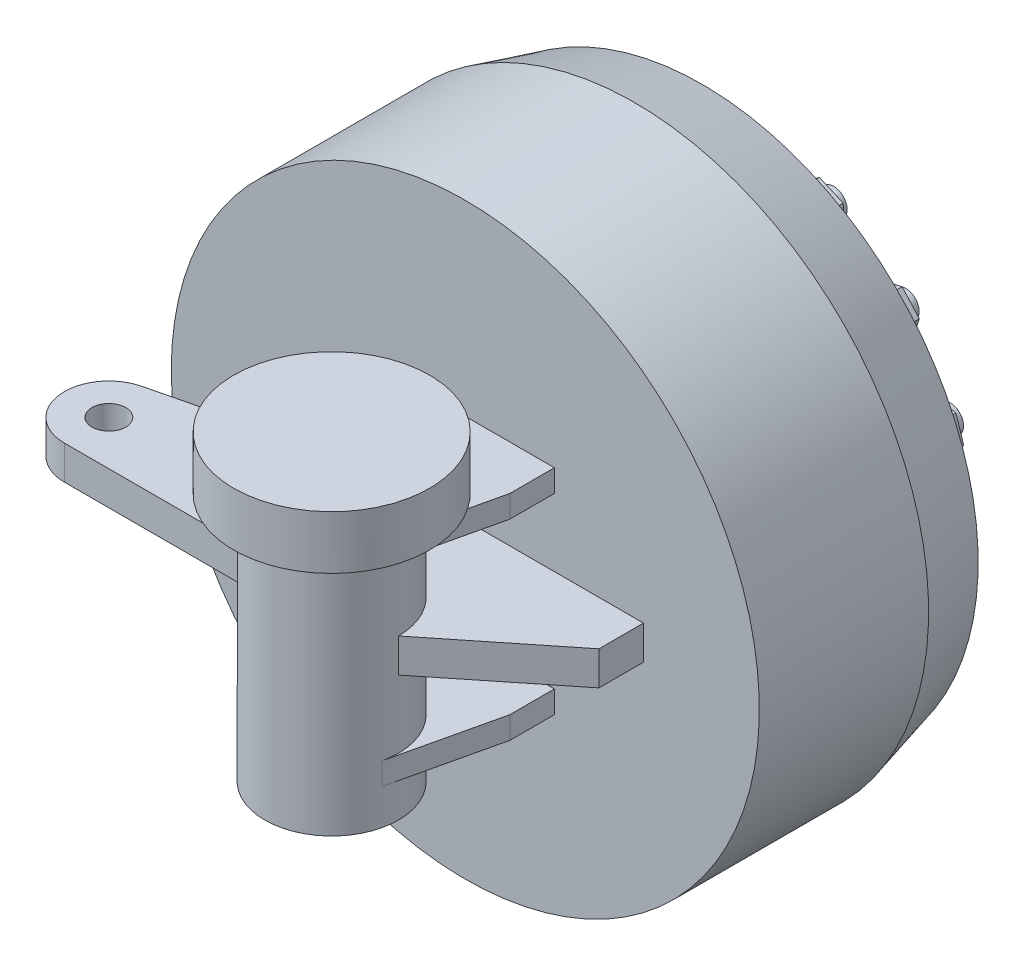
from build123d import *

# Parameters (mm, degrees)
CHAMFER1_SIZE            = 4
FILLET1_R                = 3.5
FILLET2_R                = 3.5
BOSS_EXTRUDE1_DEPTH      = 90
BOSS_EXTRUDE1_DEPTH_BACK = 80
SKETCH2_R                = 37.5
BOSS_EXTRUDE2_START      = 60
BOSS_EXTRUDE2_DEPTH      = 12.5
SKETCH4_R                = 9.5
BOSS_EXTRUDE3_DEPTH      = 9.5
SKETCH6_R                = 55
BOSS_EXTRUDE4_DEPTH      = 30
SKETCH7_R                = 7.5
BOSS_EXTRUDE5_DEPTH      = 25
BOSS_EXTRUDE6_START      = 6
SKETCH7_3_R              = 7.5
BOSS_EXTRUDE6_DEPTH      = 12.5


with BuildPart() as part:
    # Sketch1 → Revolve1 (revolve)
    with BuildSketch(Plane(origin=(0, 0, 0), x_dir=(0, 0, -1), z_dir=(1, 0, 0)), mode=Mode.PRIVATE) as revolve1_sk:
        Polygon((0, 0), (0, 165), (95, 165), (133, 154.817930688), (133, 75), (158, 75), (158, 50), (183, 50), (183, 0), align=None)
    revolve(revolve1_sk.sketch.rotate(Axis((0, 0, -183), (0, 0, 1)), 90), axis=Axis((0, 0, -183), (0, 0, 1)))

    # Chamfer1
    chamfer1_edges = [part.edges().sort_by_distance(p)[0] for p in [
        (50, 0, -183),
    ]]
    chamfer(chamfer1_edges, length=CHAMFER1_SIZE)

    # Fillet1
    fillet1_edges = [part.edges().sort_by_distance(p)[0] for p in [
        (50, 0, -158),
    ]]
    fillet(fillet1_edges, radius=FILLET1_R)

    # Fillet2
    fillet2_edges = [part.edges().sort_by_distance(p)[0] for p in [
        (75, 0, -158),
    ]]
    fillet(fillet2_edges, radius=FILLET2_R)



with BuildPart() as body_2:
    # Sketch2 → Boss-Extrude1 (new, two sides: drawn at the far end of the back side and taken through both)
    with BuildSketch(Plane(origin=(0, 0, 0), x_dir=(1, 0, 0), z_dir=(0, 1, 0)).offset(-BOSS_EXTRUDE1_DEPTH_BACK)):
        with Locations(Location((0, -75, 0), (0, 0, 270))):
            Circle(SKETCH2_R)
    extrude(amount=BOSS_EXTRUDE1_DEPTH + BOSS_EXTRUDE1_DEPTH_BACK)


with BuildPart() as part_1:
    add(part.part)

    add(body_2.part)  # Boss-Extrude2 merges body 2
    # Sketch3 → Boss-Extrude2 (add)
    with BuildSketch(Plane(origin=(0, 0, 0), x_dir=(1, 0, 0), z_dir=(0, 1, 0)).offset(BOSS_EXTRUDE2_START)):
        Polygon((-50, 0), (50, 0), (50, -25), (36.542960266, -83.417960266), (-36.542960266, -83.417960266), (-50, -25), align=None)
    boss_extrude2 = extrude(amount=-BOSS_EXTRUDE2_DEPTH)

    # Mirror1: Boss-Extrude2 across plane
    add(boss_extrude2.mirror(Plane.ZX))

    # Sketch4 → Boss-Extrude3 (add, symmetric)
    with BuildSketch(Plane(origin=(0, 0, 0), x_dir=(1, 0, 0), z_dir=(0, 1, 0))):
        with BuildLine():
            Line((-50, 0), (100, 0))
            Line((100, 0), (100, -25))
            Line((100, -25), (37.5, -75))
            ThreePointArc((37.5, -75), (0, -37.5), (-37.5, -75))
            Line((-37.5, -75), (-150, -75))
            ThreePointArc((-150, -75), (-174.822997079, -52.969649142), (-155.897247359, -25.705505282))
            Line((-155.897247359, -25.705505282), (-50, 0))
        make_face()
        with Locations(Location((-150, -50, 0), (0, 0, 270))):
            Circle(SKETCH4_R, mode=Mode.SUBTRACT)
    extrude(amount=BOSS_EXTRUDE3_DEPTH, both=True)

    # Sketch6 → Boss-Extrude4 (add)
    with BuildSketch(Plane(origin=(0, 60, 0), x_dir=(1, 0, 0), z_dir=(0, 1, 0))):
        with Locations(Location((0, -75, 0), (0, 0, 145.958125966))):
            Circle(SKETCH6_R)
    extrude(amount=BOSS_EXTRUDE4_DEPTH)

    # Sketch7 → Boss-Extrude5 (add)
    with BuildSketch(Plane(origin=(0, 0, -133), x_dir=(-1, 0, 0), z_dir=(0, 0, -1))):
        with Locations((-103.923048454, -60)):
            Circle(SKETCH7_R)
        with Locations((-119.342627444, -12.543415592)):
            Circle(SKETCH7_R)
        with Locations((-70.534230275, -97.082039325)):
            Circle(SKETCH7_R)
        with Locations((-24.949402898, -117.377712088)):
            Circle(SKETCH7_R)
        with Locations((70.534230275, -97.082039325)):
            Circle(SKETCH7_R)
        with Locations((103.923048454, -60)):
            Circle(SKETCH7_R)
        with Locations((119.342627444, -12.543415592)):
            Circle(SKETCH7_R)
        with Locations((114.126781955, 37.082039325)):
            Circle(SKETCH7_R)
        with Locations((89.177379057, 80.295672763)):
            Circle(SKETCH7_R)
        with Locations((48.808397169, 109.625454917)):
            Circle(SKETCH7_R)
        with Locations((-48.808397169, 109.625454917)):
            Circle(SKETCH7_R)
        with Locations((-89.177379057, 80.295672763)):
            Circle(SKETCH7_R)
        with Locations((-114.126781955, 37.082039325)):
            Circle(SKETCH7_R)
        with Locations((0, 120)):
            Circle(SKETCH7_R)
        with Locations((24.949402898, -117.377712088)):
            Circle(SKETCH7_R)
    extrude(amount=BOSS_EXTRUDE5_DEPTH)

    # Sketch7<3> → Boss-Extrude6 (add)
    # profile 1 of 15: a face of its own
    with BuildSketch(Plane(origin=(0, 0, -133), x_dir=(-1, 0, 0), z_dir=(0, 0, -1)).offset(BOSS_EXTRUDE6_START)):
        Polygon((61.994290066, 103.754717158), (60.485551656, 118.109404258), (47.299658759, 123.980142017), (35.622504272, 115.496192676), (37.131242682, 101.141505576), (50.317135579, 95.270767817), align=None)
        with Locations((48.808397169, 109.625454917)):
            Circle(SKETCH7_3_R, mode=Mode.SUBTRACT)
    # profile 2 of 15: a face of its own
    with BuildSketch(Plane(origin=(0, 0, -133), x_dir=(-1, 0, 0), z_dir=(0, 0, -1)).offset(BOSS_EXTRUDE6_START)):
        Polygon((7.216878365, 132.5), (-7.216878365, 132.5), (-14.43375673, 120), (-7.216878365, 107.5), (7.216878365, 107.5), (14.43375673, 120), align=None)
        with Locations((0, 120)):
            Circle(SKETCH7_3_R, mode=Mode.SUBTRACT)
    # profile 3 of 15: a face of its own
    with BuildSketch(Plane(origin=(0, 0, -133), x_dir=(-1, 0, 0), z_dir=(0, 0, -1)).offset(BOSS_EXTRUDE6_START)):
        Polygon((98.83544745, 69.569301137), (103.295723572, 83.29661953), (93.637655179, 94.022991156), (79.519310665, 91.022044389), (75.059034543, 77.294725997), (84.717102935, 66.568354371), align=None)
        with Locations((89.177379057, 80.295672763)):
            Circle(SKETCH7_3_R, mode=Mode.SUBTRACT)
    # profile 4 of 15: a face of its own
    with BuildSketch(Plane(origin=(0, 0, -133), x_dir=(-1, 0, 0), z_dir=(0, 0, -1)).offset(BOSS_EXTRUDE6_START)):
        Polygon((118.587058078, 23.354720933), (128.24512647, 34.081092558), (123.784850348, 47.808410951), (109.666505833, 50.809357717), (100.008437441, 40.082986092), (104.468713563, 26.355667699), align=None)
        with Locations((114.126781955, 37.082039325)):
            Circle(SKETCH7_3_R, mode=Mode.SUBTRACT)
    # profile 5 of 15: a face of its own
    with BuildSketch(Plane(origin=(0, 0, -133), x_dir=(-1, 0, 0), z_dir=(0, 0, -1)).offset(BOSS_EXTRUDE6_START)):
        Polygon((117.833889034, -26.898102692), (131.019781931, -21.027364933), (132.528520341, -6.672677833), (120.851365854, 1.811271508), (107.665472957, -4.059466251), (106.156734547, -18.414153351), align=None)
        with Locations((119.342627444, -12.543415592)):
            Circle(SKETCH7_3_R, mode=Mode.SUBTRACT)
    # profile 6 of 15: a face of its own
    with BuildSketch(Plane(origin=(0, 0, -133), x_dir=(-1, 0, 0), z_dir=(0, 0, -1)).offset(BOSS_EXTRUDE6_START)):
        Polygon((96.706170089, -72.5), (111.139926819, -72.5), (118.356805184, -60), (111.139926819, -47.5), (96.706170089, -47.5), (89.489291724, -60), align=None)
        with Locations((103.923048454, -60)):
            Circle(SKETCH7_3_R, mode=Mode.SUBTRACT)
    # profile 7 of 15: a face of its own
    with BuildSketch(Plane(origin=(0, 0, -133), x_dir=(-1, 0, 0), z_dir=(0, 0, -1)).offset(BOSS_EXTRUDE6_START)):
        Polygon((58.857075788, -105.565988666), (72.042968685, -111.436726425), (83.720123172, -102.952777084), (82.211384762, -88.598089984), (69.025491865, -82.727352225), (57.348337378, -91.211301566), align=None)
        with Locations((70.534230275, -97.082039325)):
            Circle(SKETCH7_3_R, mode=Mode.SUBTRACT)
    # profile 8 of 15: a face of its own
    with BuildSketch(Plane(origin=(0, 0, -133), x_dir=(-1, 0, 0), z_dir=(0, 0, -1)).offset(BOSS_EXTRUDE6_START)):
        Polygon((10.831058383, -120.378658855), (20.489126776, -131.10503048), (34.607471291, -128.104083714), (39.067747413, -114.376765322), (29.40967902, -103.650393696), (15.291334506, -106.651340462), align=None)
        with Locations((24.949402898, -117.377712088)):
            Circle(SKETCH7_3_R, mode=Mode.SUBTRACT)
    # profile 9 of 15: a face of its own
    with BuildSketch(Plane(origin=(0, 0, -133), x_dir=(-1, 0, 0), z_dir=(0, 0, -1)).offset(BOSS_EXTRUDE6_START)):
        Polygon((-39.067747413, -114.376765322), (-34.607471291, -128.104083714), (-20.489126776, -131.10503048), (-10.831058383, -120.378658855), (-15.291334506, -106.651340462), (-29.40967902, -103.650393696), align=None)
        with Locations((-24.949402898, -117.377712088)):
            Circle(SKETCH7_3_R, mode=Mode.SUBTRACT)
    # profile 10 of 15: a face of its own
    with BuildSketch(Plane(origin=(0, 0, -133), x_dir=(-1, 0, 0), z_dir=(0, 0, -1)).offset(BOSS_EXTRUDE6_START)):
        Polygon((-82.211384762, -88.598089984), (-83.720123172, -102.952777084), (-72.042968685, -111.436726425), (-58.857075788, -105.565988666), (-57.348337378, -91.211301566), (-69.025491865, -82.727352225), align=None)
        with Locations((-70.534230275, -97.082039325)):
            Circle(SKETCH7_3_R, mode=Mode.SUBTRACT)
    # profile 11 of 15: a face of its own
    with BuildSketch(Plane(origin=(0, 0, -133), x_dir=(-1, 0, 0), z_dir=(0, 0, -1)).offset(BOSS_EXTRUDE6_START)):
        Polygon((-111.139926819, -47.5), (-118.356805184, -60), (-111.139926819, -72.5), (-96.706170089, -72.5), (-89.489291724, -60), (-96.706170089, -47.5), align=None)
        with Locations((-103.923048454, -60)):
            Circle(SKETCH7_3_R, mode=Mode.SUBTRACT)
    # profile 12 of 15: a face of its own
    with BuildSketch(Plane(origin=(0, 0, -133), x_dir=(-1, 0, 0), z_dir=(0, 0, -1)).offset(BOSS_EXTRUDE6_START)):
        Polygon((-120.851365854, 1.811271508), (-132.528520341, -6.672677833), (-131.019781931, -21.027364933), (-117.833889034, -26.898102692), (-106.156734547, -18.414153351), (-107.665472957, -4.059466251), align=None)
        with Locations((-119.342627444, -12.543415592)):
            Circle(SKETCH7_3_R, mode=Mode.SUBTRACT)
    # profile 13 of 15: a face of its own
    with BuildSketch(Plane(origin=(0, 0, -133), x_dir=(-1, 0, 0), z_dir=(0, 0, -1)).offset(BOSS_EXTRUDE6_START)):
        Polygon((-109.666505833, 50.809357717), (-123.784850348, 47.808410951), (-128.24512647, 34.081092558), (-118.587058078, 23.354720933), (-104.468713563, 26.355667699), (-100.008437441, 40.082986092), align=None)
        with Locations((-114.126781955, 37.082039325)):
            Circle(SKETCH7_3_R, mode=Mode.SUBTRACT)
    # profile 14 of 15: a face of its own
    with BuildSketch(Plane(origin=(0, 0, -133), x_dir=(-1, 0, 0), z_dir=(0, 0, -1)).offset(BOSS_EXTRUDE6_START)):
        Polygon((-79.519310665, 91.022044389), (-93.637655179, 94.022991156), (-103.295723572, 83.29661953), (-98.83544745, 69.569301137), (-84.717102935, 66.568354371), (-75.059034543, 77.294725997), align=None)
        with Locations((-89.177379057, 80.295672763)):
            Circle(SKETCH7_3_R, mode=Mode.SUBTRACT)
    # profile 15 of 15: a face of its own
    with BuildSketch(Plane(origin=(0, 0, -133), x_dir=(-1, 0, 0), z_dir=(0, 0, -1)).offset(BOSS_EXTRUDE6_START)):
        Polygon((-35.622504272, 115.496192676), (-47.299658759, 123.980142017), (-60.485551656, 118.109404258), (-61.994290066, 103.754717158), (-50.317135579, 95.270767817), (-37.131242682, 101.141505576), align=None)
        with Locations((-48.808397169, 109.625454917)):
            Circle(SKETCH7_3_R, mode=Mode.SUBTRACT)
    extrude(amount=BOSS_EXTRUDE6_DEPTH)


solid = part_1.part
